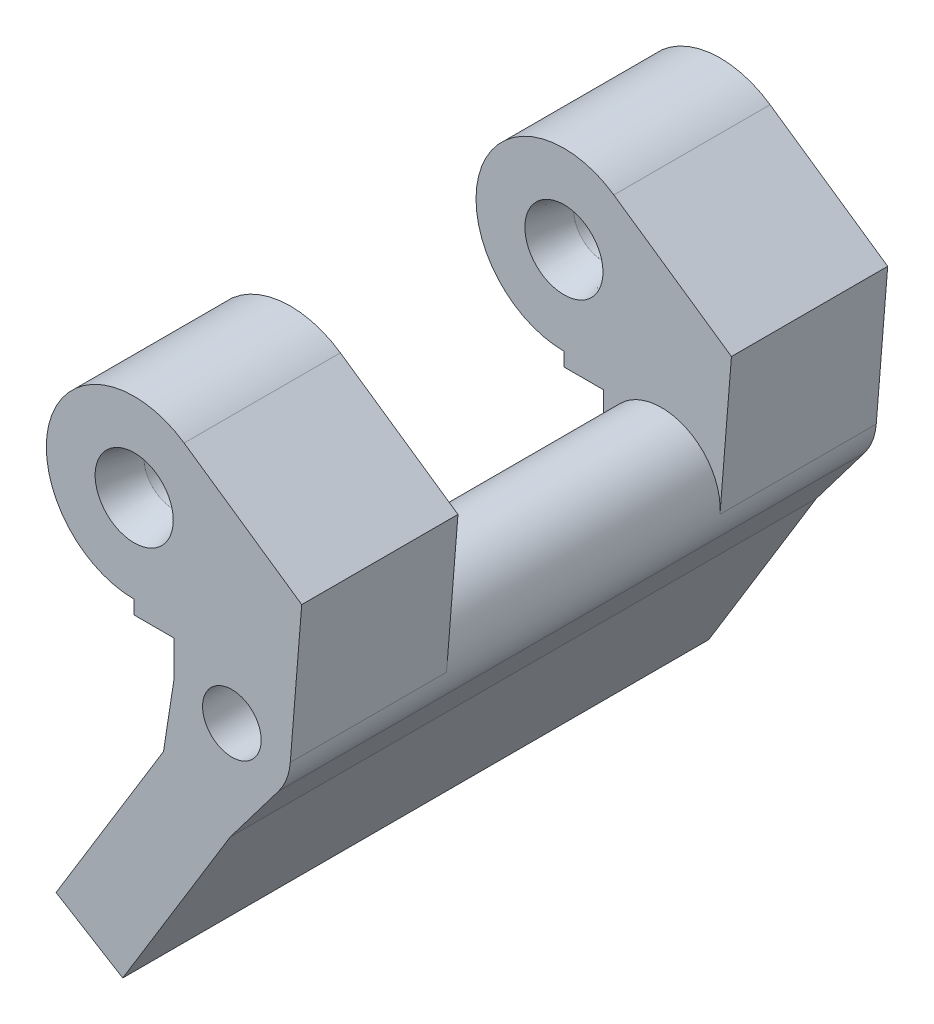
from build123d import *
from OCP.BRepFilletAPI import BRepFilletAPI_MakeChamfer

# Parameters (mm, degrees)
SKETCH1_R           = 3
SKETCH1_R_2         = 1.5
BOSS_EXTRUDE1_DEPTH = 30
SKETCH1_5_R         = 4.5
SKETCH1_5_R_2       = 1.5
SKETCH1_5_W         = 2.035294118
SKETCH1_5_H         = 0.7
BOSS_EXTRUDE2_DEPTH = 8
LPATTERN1_COUNT     = 2
LPATTERN1_PITCH     = 22
CHAMFER1_SIZE       = 0.5
CHAMFER1_SIZE2      = 2
CHAMFER2_SIZE       = 2
CHAMFER2_SIZE2      = 0.5
CHAMFER3_SIZE       = 2
CHAMFER3_SIZE2      = 0.5


with BuildPart() as part:
    # Sketch1 → Boss-Extrude1 (new body)
    # profile 1 of 3: a face of its own
    with BuildSketch(Plane.XY):
        Polygon((22, -14.489354466), (25.413127335, -16.575154503), (19.913127335, -25.575154503), (16.5, -23.489354466), align=None)
    # profile 2 of 3: a face of its own
    with BuildSketch(Plane.XY):
        with BuildLine():
            Line((22.535294118, -11.030530936), (22, -14.489354466))
            Line((22, -14.489354466), (25.413127335, -16.575154503))
            Line((25.413127335, -16.575154503), (27.892093962, -13.2998479))
            ThreePointArc((27.892093962, -13.2998479), (24.329777383, -14.251704738), (22.535294118, -11.030530936))
        make_face()
    # profile 3 of 3: a face of its own
    with BuildSketch(Plane.XY):
        with Locations((25.5, -11.489354466)):
            Circle(SKETCH1_R)
        with Locations((25.5, -11.489354466)):
            Circle(SKETCH1_R_2, mode=Mode.SUBTRACT)
    extrude(amount=-BOSS_EXTRUDE1_DEPTH)

    # Sketch1<5> → Boss-Extrude2 (add)
    # profile 1 of 3: a face of its own
    with BuildSketch(Plane.XY):
        with BuildLine():
            Line((22.535294118, -9.189354466), (22.535294118, -11.030530936))
            ThreePointArc((22.535294118, -11.030530936), (25.730089497, -8.498191009), (28.5, -11.489354466))
            ThreePointArc((28.5, -11.489354466), (28.497587401, -11.609644848), (28.490353483, -11.729741755))
            Line((28.490353483, -11.729741755), (29.076489945, -4.438361169))
            Line((29.076489945, -4.438361169), (23.055037361, -0.285061809))
            ThreePointArc((23.055037361, -0.285061809), (24.484198045, -1.897425705), (25, -3.989354466))
            ThreePointArc((25, -3.989354466), (23.681980515, -7.171334981), (20.5, -8.489354466))
            Line((20.5, -8.489354466), (22.535294118, -8.489354466))
            Line((22.535294118, -8.489354466), (22.535294118, -9.189354466))
        make_face()
    # profile 2 of 3: a face of its own
    with BuildSketch(Plane.XY):
        with Locations((20.5, -3.989354466)):
            Circle(SKETCH1_5_R)
        with Locations((20.5, -3.989354466)):
            Circle(SKETCH1_5_R_2, mode=Mode.SUBTRACT)
    # profile 3 of 3: a face of its own
    with BuildSketch(Plane.XY):
        with Locations((21.517647059, -8.839354466)):
            Rectangle(SKETCH1_5_W, SKETCH1_5_H)
    boss_extrude2 = extrude(amount=-BOSS_EXTRUDE2_DEPTH)

    # LPattern1: Boss-Extrude2 ×2
    with Locations(*[(0, 0, -i * LPATTERN1_PITCH) for i in range(1, LPATTERN1_COUNT)]):
        add(boss_extrude2)

    # Chamfer1: one chamfer whose edges measure the first distance from different faces: ONE call of the kernel's chamfer builder (chamfer() names one face for all edges)
    chamfer1_edges_1 = [part.edges().sort_by_distance(p)[0] for p in [
        (19, -3.989354466, 0),
    ]]
    chamfer1_side_1 = [part.faces().sort_by_distance(p)[0] for p in [
        (22.584533606, -10.229298643, 0),
    ]]
    chamfer1_edges_2 = [part.edges().sort_by_distance(p)[0] for p in [
        (19, -3.989354466, -22),
    ]]
    chamfer1_side_2 = [part.faces().sort_by_distance(p)[0] for p in [
        (22.505894665, -4.865120782, -22),
    ]]
    chamfer1 = BRepFilletAPI_MakeChamfer(part.part.solid().wrapped)
    for e in chamfer1_edges_1:
        chamfer1.Add(CHAMFER1_SIZE, CHAMFER1_SIZE2, e.wrapped, chamfer1_side_1[0].wrapped)  # the first distance lies on this face
    for e in chamfer1_edges_2:
        chamfer1.Add(CHAMFER1_SIZE, CHAMFER1_SIZE2, e.wrapped, chamfer1_side_2[0].wrapped)  # the first distance lies on this face
    add(Compound.cast(chamfer1.Shape()), mode=Mode.REPLACE)

    # Chamfer2
    chamfer2_edges = [part.edges().sort_by_distance(p)[0] for p in [
        (19, -3.989354466, -8),
    ]]
    chamfer2_side = [part.faces().sort_by_distance(p)[0] for p in [
        (19, -3.989354466, -5),
    ]]
    chamfer(chamfer2_edges, length=CHAMFER2_SIZE, length2=CHAMFER2_SIZE2, reference=chamfer2_side[0])

    # Chamfer3
    chamfer3_edges = [part.edges().sort_by_distance(p)[0] for p in [
        (19, -3.989354466, -30),
    ]]
    chamfer3_side = [part.faces().sort_by_distance(p)[0] for p in [
        (19, -3.989354466, -27),
    ]]
    chamfer(chamfer3_edges, length=CHAMFER3_SIZE, length2=CHAMFER3_SIZE2, reference=chamfer3_side[0])


solid = part.part
